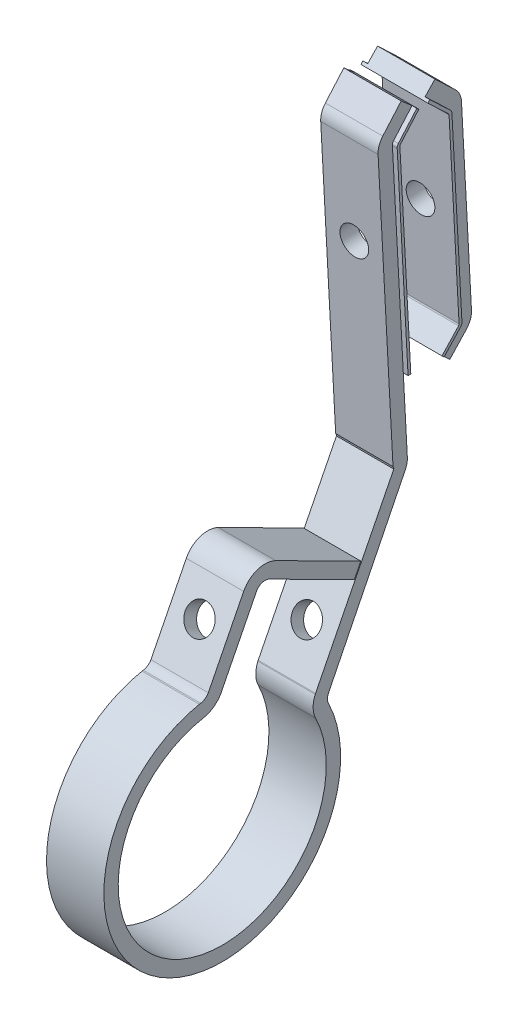
from build123d import *

# Parameters (mm, degrees)
Y_KSEKLIK_EKSTR_ZYON1_DEPTH      = 12
Y_KSEKLIK_EKSTR_ZYON1_2_DEPTH    = 12
Y_KSEKLIK_EKSTR_ZYON2_DEPTH      = 13
Y_KSEKLIK_EKSTR_ZYON2_DEPTH_BACK = 1
KES_EKSTR_ZYON1_DEPTH            = 137.801379342
KES_EKSTR_ZYON1_DEPTH_BACK       = 137.801379342
IZIM3_R                          = 3
KES_EKSTR_ZYON2_DEPTH            = 126.375180465
KES_EKSTR_ZYON2_DEPTH_BACK       = 126.375180465
IZIM4_R                          = 3


with BuildPart() as part:
    # Çizim1 → Yükseklik-Ekstrüzyon1 (new body)
    with BuildSketch(Plane(origin=(0, 0, 0), x_dir=(0, 0, -1), z_dir=(1, 0, 0))):
        with BuildLine():
            Line((39.703698303, 110.530564835), (35.842735006, 106.093640789))
            ThreePointArc((35.842735006, 106.093640789), (35.651443933, 105.762341111), (35.598552367, 105.383455596))
            Line((35.598552367, 105.383455596), (38.726763322, 47.255829212))
            ThreePointArc((38.726763322, 47.255829212), (38.650109509, 46.232992954), (38.315858613, 45.263278483))
            Line((38.315858613, 45.263278483), (22.20008442, 12.776775479))
            ThreePointArc((22.20008442, 12.776775479), (22.01624938, 11.793069649), (22.275463947, 10.826487893))
            ThreePointArc((22.275463947, 10.826487893), (-11.039027997, -22.170904245), (-4.785595814, 24.300354048))
            Line((-4.785595814, 24.300354048), (-4.533073597, 24.348724359))
            ThreePointArc((-4.533073597, 24.348724359), (-3.601683862, 24.714764855), (-2.919855141, 25.447282485))
            Line((-2.919855141, 25.447282485), (4.481637012, 40.121125879))
            ThreePointArc((4.481637012, 40.121125879), (7.381427348, 42.618299671), (11.19765728, 42.333606783))
            Line((11.19765728, 42.333606783), (28.993707017, 33.357272572))
            Line((28.993707017, 33.357272572), (27.642645207, 30.67872222))
            Line((27.642645207, 30.67872222), (9.846595471, 39.655056431))
            ThreePointArc((9.846595471, 39.655056431), (8.320103498, 39.768933586), (7.160187363, 38.77006407))
            Line((7.160187363, 38.77006407), (-0.241304789, 24.096220675))
            Line((-0.241304789, 24.096220675), (-0.325680691, 23.940544642))
            ThreePointArc((-0.325680691, 23.940544642), (-1.807938736, 22.308616532), (-3.828892979, 21.427695299))
            ThreePointArc((-3.828892979, 21.427695299), (-9.802898187, -19.434755836), (19.507842092, 9.656637312))
            ThreePointArc((19.507842092, 9.656637312), (19.015096672, 11.805469604), (19.446489735, 13.967454409))
            Line((19.446489735, 13.967454409), (19.521534068, 14.127837289))
            Line((19.521534068, 14.127837289), (35.891741207, 46.582624912))
            ThreePointArc((35.891741207, 46.582624912), (35.846402617, 46.849595664), (35.731098192, 47.094613744))
            Line((35.731098192, 47.094613744), (32.602887237, 105.222240128))
            ThreePointArc((32.602887237, 105.222240128), (32.814453502, 106.737782188), (33.579617792, 108.062980901))
            Line((33.579617792, 108.062980901), (37.440581089, 112.499904947))
            Line((37.440581089, 112.499904947), (39.703698303, 110.530564835))
        make_face()
    extrude(amount=Y_KSEKLIK_EKSTR_ZYON1_DEPTH)



with BuildPart() as body_2:
    # Çizim1 → Y_kseklik-Ekstr_zyon1 2 (new body)
    with BuildSketch(Plane(origin=(0, 0, 0), x_dir=(0, 0, -1), z_dir=(1, 0, 0))):
        with BuildLine():
            Line((42.430036911, 110.758141291), (46.744907402, 106.651384134))
            ThreePointArc((46.744907402, 106.651384134), (46.963640098, 106.345658403), (47.05403938, 105.980774606))
            Line((47.05403938, 105.980774606), (49.147439107, 67.090085781))
            ThreePointArc((49.147439107, 67.090085781), (49.08906574, 66.695660627), (48.881223656, 66.355395554))
            Line((48.881223656, 66.355395554), (45.416029412, 62.628641566))
            Line((45.416029412, 62.628641566), (47.613046335, 60.585820811))
            Line((47.613046335, 60.585820811), (51.078240579, 64.312574798))
            ThreePointArc((51.078240579, 64.312574798), (51.909608915, 65.673635091), (52.143102382, 67.251335707))
            Line((52.143102382, 67.251335707), (50.049702655, 106.142024532))
            ThreePointArc((50.049702655, 106.142024532), (49.688105529, 107.601559718), (48.813174743, 108.824462642))
            Line((48.813174743, 108.824462642), (44.498304253, 112.9312198))
            Line((44.498304253, 112.9312198), (42.430036911, 110.758141291))
        make_face()
    extrude(amount=Y_KSEKLIK_EKSTR_ZYON1_2_DEPTH)


with BuildPart() as part_1:
    add(part.part)

    add(body_2.part)  # Yükseklik-Ekstrüzyon2 merges body 2
    # Çizim2 → Yükseklik-Ekstrüzyon2 (add, two sides: drawn at the far end of the back side and taken through both)
    with BuildSketch(Plane(origin=(0, 0, 0), x_dir=(0, 0, -1), z_dir=(1, 0, 0)).offset(-Y_KSEKLIK_EKSTR_ZYON2_DEPTH_BACK)):
        with BuildLine():
            Line((39.703698303, 110.530564835), (35.842735006, 106.093640789))
            ThreePointArc((35.842735006, 106.093640789), (35.651443933, 105.762341111), (35.598552367, 105.383455596))
            Line((35.598552367, 105.383455596), (37.878903007, 63.010555577))
            Line((37.878903007, 63.010555577), (38.449727824, 63.010555577))
            Line((38.449727824, 63.010555577), (36.167728742, 105.414086535))
            ThreePointArc((36.167728742, 105.414086535), (36.190472115, 105.577007306), (36.272727276, 105.719466168))
            Line((36.272727276, 105.719466168), (40.133690573, 110.156390214))
            Line((40.133690573, 110.156390214), (39.703698303, 110.530564835))
        make_face()
        with BuildLine():
            Line((42.430036911, 110.758141291), (46.744907402, 106.651384134))
            ThreePointArc((46.744907402, 106.651384134), (46.963640098, 106.345658403), (47.05403938, 105.980774606))
            Line((47.05403938, 105.980774606), (49.147439107, 67.090085781))
            ThreePointArc((49.147439107, 67.090085781), (49.08906574, 66.695660627), (48.881223656, 66.355395554))
            Line((48.881223656, 66.355395554), (45.416029412, 62.628641566))
            Line((45.416029412, 62.628641566), (44.976626027, 63.037205717))
            Line((44.976626027, 63.037205717), (48.441820271, 66.763959705))
            ThreePointArc((48.441820271, 66.763959705), (48.524957105, 66.900065734), (48.548306451, 67.057835796))
            Line((48.548306451, 67.057835796), (46.454906724, 105.948524621))
            ThreePointArc((46.454906724, 105.948524621), (46.418747012, 106.09447814), (46.331253933, 106.216768432))
            Line((46.331253933, 106.216768432), (42.016383443, 110.32352559))
            Line((42.016383443, 110.32352559), (42.430036911, 110.758141291))
        make_face()
    extrude(amount=Y_KSEKLIK_EKSTR_ZYON2_DEPTH + Y_KSEKLIK_EKSTR_ZYON2_DEPTH_BACK)

    # Çizim3 → Kes-Ekstrüzyon1 (cut, two sides: drawn at the far end of the back side and taken through both)
    with BuildSketch(Plane(origin=(0, 2.992932096, -55.601990066), x_dir=(-1, 0, 0), z_dir=(0, 0.053749975234598533, -0.9985544252379438)).offset(-KES_EKSTR_ZYON1_DEPTH_BACK)):
        with Locations(Location((-6, 84.106186527, 0), (0, 0, 90))):
            Circle(IZIM3_R)
    extrude(amount=KES_EKSTR_ZYON1_DEPTH + KES_EKSTR_ZYON1_DEPTH_BACK, mode=Mode.SUBTRACT)

    # Çizim4 → Kes-Ekstrüzyon2 (cut, two sides: drawn at the far end of the back side and taken through both)
    with BuildSketch(Plane(origin=(0, 6.335253503, 12.55996978), x_dir=(1, 0, 0), z_dir=(0, 0.45035393648807964, 0.8928501172591571)).offset(-KES_EKSTR_ZYON2_DEPTH_BACK)):
        with Locations(Location((6, 30.650474816, 0), (0, 0, 90))):
            Circle(IZIM4_R)
    extrude(amount=KES_EKSTR_ZYON2_DEPTH + KES_EKSTR_ZYON2_DEPTH_BACK, mode=Mode.SUBTRACT)


solid = part_1.part
